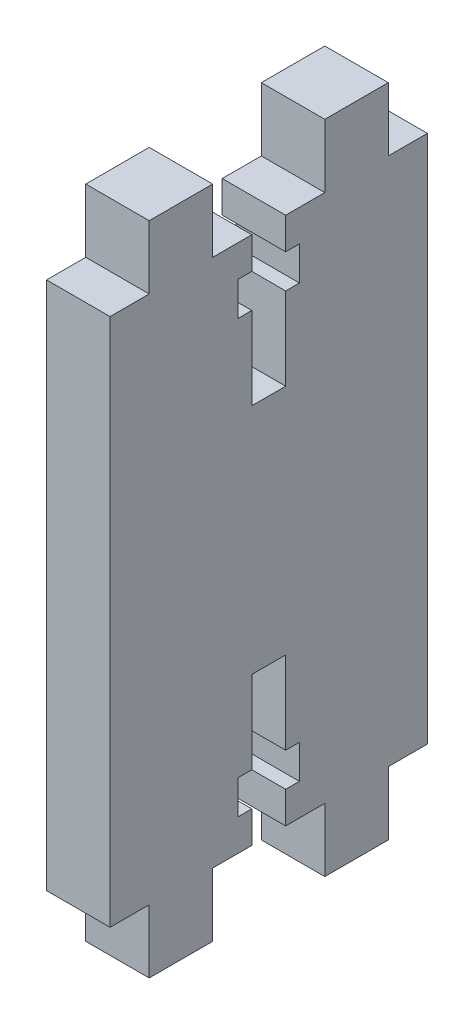
from build123d import *

# Parameters (mm, degrees)
BOSS_EXTRUDE1_DEPTH = 6


with BuildPart() as part:
    # Sketch1 → Boss-Extrude1 (new body)
    with BuildSketch(Plane(origin=(0, 0, 0), x_dir=(0, 0, -1), z_dir=(1, 0, 0))):
        Polygon((-15, -25), (-15, 25), (-11.3, 25), (-11.3, 31), (-5.3, 31), (-5.3, 25), (-1.6, 25), (-1.6, 22), (-2.9, 22), (-2.9, 18.8), (-1.6, 18.8), (-1.6, 11), (1.6, 11), (1.6, 18.8), (2.9, 18.8), (2.9, 22), (1.6, 22), (1.6, 25), (5.3, 25), (5.3, 31), (11.3, 31), (11.3, 25), (15, 25), (15, -25), (11.3, -25), (11.3, -31), (5.3, -31), (5.3, -25), (1.6, -25), (1.6, -22), (2.9, -22), (2.9, -18.8), (1.6, -18.8), (1.6, -11), (-1.6, -11), (-1.6, -18.8), (-2.9, -18.8), (-2.9, -22), (-1.6, -22), (-1.6, -25), (-5.3, -25), (-5.3, -31), (-11.3, -31), (-11.3, -25), align=None)
    extrude(amount=BOSS_EXTRUDE1_DEPTH)


solid = part.part
